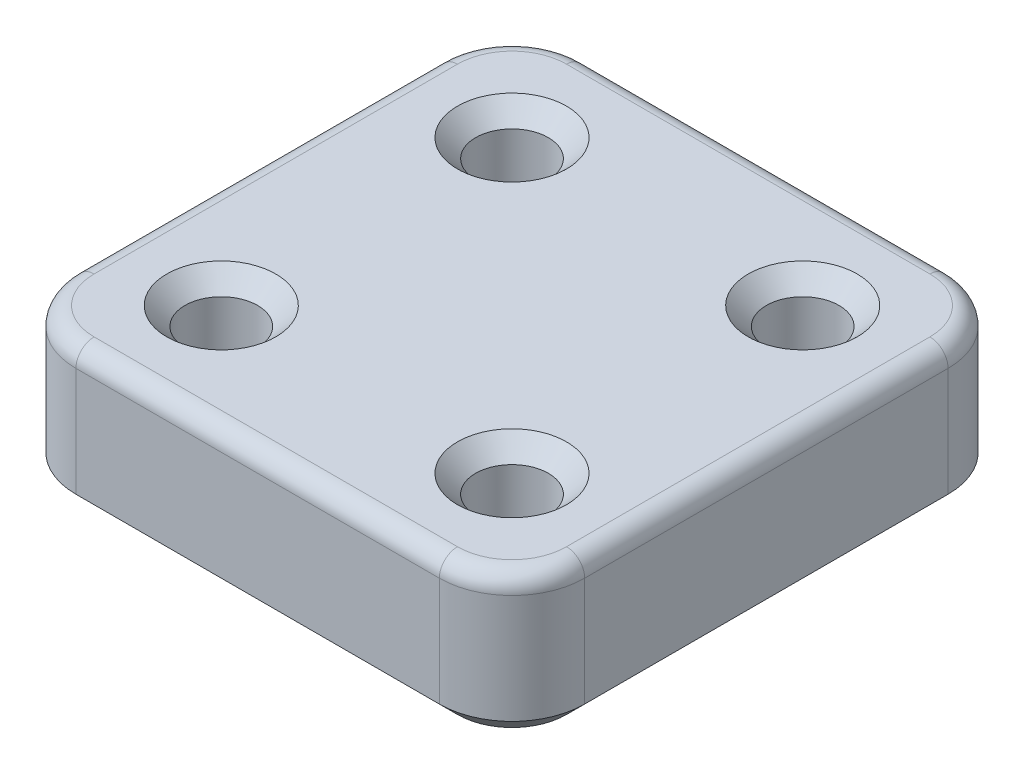
from build123d import *

# Parameters (mm, degrees)
SKETCH2_W           = 44.45
SKETCH2_H           = 44.45
SKETCH2_R           = 3.175
BOSS_EXTRUDE1_DEPTH = 12.7
FILLET1_R           = 6.35
FILLET2_R           = 1.5875
CHAMFER1_SIZE       = 1.5875


with BuildPart() as part:
    # Sketch2 → Boss-Extrude1 (new body)
    with BuildSketch(Plane(origin=(0, 0, 0), x_dir=(1, 0, 0), z_dir=(0, 1, 0))):
        Rectangle(SKETCH2_W, SKETCH2_H)
        with Locations(Location((-12.7, -12.7, 0), (0, 0, 270))):
            Circle(SKETCH2_R, mode=Mode.SUBTRACT)
        with Locations(Location((12.7, -12.7, 0), (0, 0, 270))):
            Circle(SKETCH2_R, mode=Mode.SUBTRACT)
        with Locations(Location((12.7, 12.7, 0), (0, 0, 270))):
            Circle(SKETCH2_R, mode=Mode.SUBTRACT)
        with Locations(Location((-12.7, 12.7, 0), (0, 0, 270))):
            Circle(SKETCH2_R, mode=Mode.SUBTRACT)
    extrude(amount=BOSS_EXTRUDE1_DEPTH)

    # Fillet1
    fillet1_edges = [part.edges().sort_by_distance(p)[0] for p in [
        (22.225, 6.35, 22.225),
        (-22.225, 6.35, 22.225),
        (-22.225, 6.35, -22.225),
        (22.225, 6.35, -22.225),
    ]]
    fillet(fillet1_edges, radius=FILLET1_R)

    # Fillet2
    fillet2_edges = [part.edges().sort_by_distance(p)[0] for p in [
        (22.225, 12.7, 0),
        (0, 12.7, 22.225),
        (0, 12.7, -22.225),
        (-22.225, 12.7, 0),
        (-20.365128061, 12.7, 20.365128061),
        (20.365128061, 12.7, -20.365128061),
        (-20.365128061, 12.7, -20.365128061),
        (20.365128061, 12.7, 20.365128061),
    ]]
    fillet(fillet2_edges, radius=FILLET2_R)

    # Chamfer1
    chamfer1_edges = [part.edges().sort_by_distance(p)[0] for p in [
        (-12.7, 0, 9.525),
        (-12.7, 12.7, 9.525),
        (12.7, 0, 9.525),
        (12.7, 12.7, 9.525),
        (12.7, 0, -15.875),
        (12.7, 12.7, -15.875),
        (-12.7, 0, -15.875),
        (-12.7, 12.7, -15.875),
        (22.225, 0, 0),
        (0, 0, 22.225),
        (-22.225, 0, 0),
        (0, 0, -22.225),
        (-20.365128061, 0, 20.365128061),
        (20.365128061, 0, -20.365128061),
        (-20.365128061, 0, -20.365128061),
        (20.365128061, 0, 20.365128061),
    ]]
    chamfer(chamfer1_edges, length=CHAMFER1_SIZE)


solid = part.part
